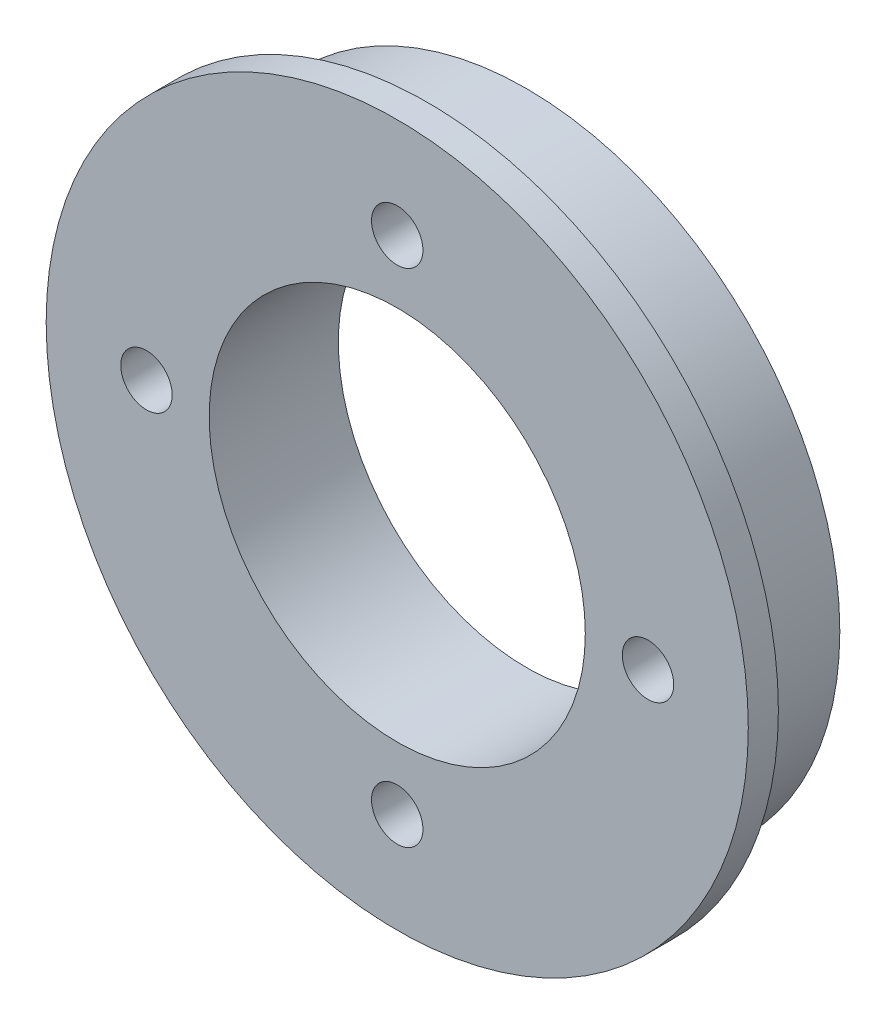
from build123d import *

# Parameters (mm, degrees)
SKETCH_1_R               = 12.5
SKETCH_1_R_2             = 7.5
EXTRUDE_1_DEPTH          = 3.95
SKETCH_2_R               = 14
SKETCH_2_R_2             = 7.5
EXTRUDE_2_DEPTH          = 1.2
HOLE_WIZARD_M2_5_1_D     = 2.05
PATTERN_CIRCULAR_1_COUNT = 4


with BuildPart() as part:
    # 草图1 → 凸台-拉伸1 (new body)
    with BuildSketch(Plane.XY):
        Circle(SKETCH_1_R)
        Circle(SKETCH_1_R_2, mode=Mode.SUBTRACT)
    extrude(amount=EXTRUDE_1_DEPTH)

    # 草图2 → 凸台-拉伸2 (add)
    with BuildSketch(Plane.XY.offset(3.95)):
        Circle(SKETCH_2_R)
        Circle(SKETCH_2_R_2, mode=Mode.SUBTRACT)
    extrude(amount=EXTRUDE_2_DEPTH)

    # M2.5 螺纹孔1 (through all)
    with Locations(Plane(origin=(0, 0, 0), x_dir=(-1, 0, 0), z_dir=(0, 0, -1))):
        with Locations((0, 10)):
            hole_wizard_m2_5_1 = Hole(HOLE_WIZARD_M2_5_1_D / 2)

    # 阵列(圆周)1: M2.5 螺纹孔1 ×4 about axis
    pattern_circular_1_axis = Axis((0, 0, 0), (0, 0, 1))
    for i in range(1, PATTERN_CIRCULAR_1_COUNT):
        add(hole_wizard_m2_5_1.rotate(pattern_circular_1_axis, i * 360 / PATTERN_CIRCULAR_1_COUNT), mode=Mode.SUBTRACT)


solid = part.part
